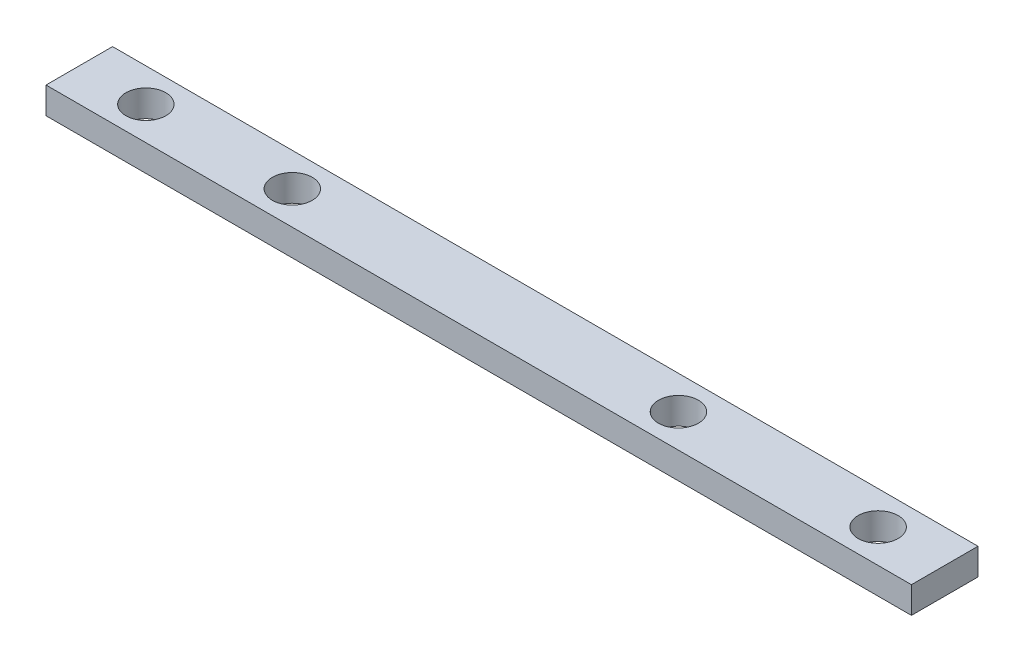
from build123d import *

# Parameters (mm, degrees)
SKETCH_1_W      = 65
SKETCH_1_H      = 5
SKETCH_1_R      = 1.5
EXTRUDE_1_DEPTH = 2


with BuildPart() as part:
    # 草图1 → 凸台-拉伸1 (new body)
    with BuildSketch(Plane(origin=(0, 0, 0), x_dir=(1, 0, 0), z_dir=(0, 1, 0))):
        with Locations((32.5, -2.5)):
            Rectangle(SKETCH_1_W, SKETCH_1_H)
        with Locations(Location((5, -2.5, 0), (0, 0, 270))):
            Circle(SKETCH_1_R, mode=Mode.SUBTRACT)
        with Locations(Location((16, -2.5, 0), (0, 0, 270))):
            Circle(SKETCH_1_R, mode=Mode.SUBTRACT)
        with Locations(Location((45, -2.5, 0), (0, 0, 270))):
            Circle(SKETCH_1_R, mode=Mode.SUBTRACT)
        with Locations(Location((60, -2.5, 0), (0, 0, 270))):
            Circle(SKETCH_1_R, mode=Mode.SUBTRACT)
    extrude(amount=EXTRUDE_1_DEPTH)


solid = part.part
